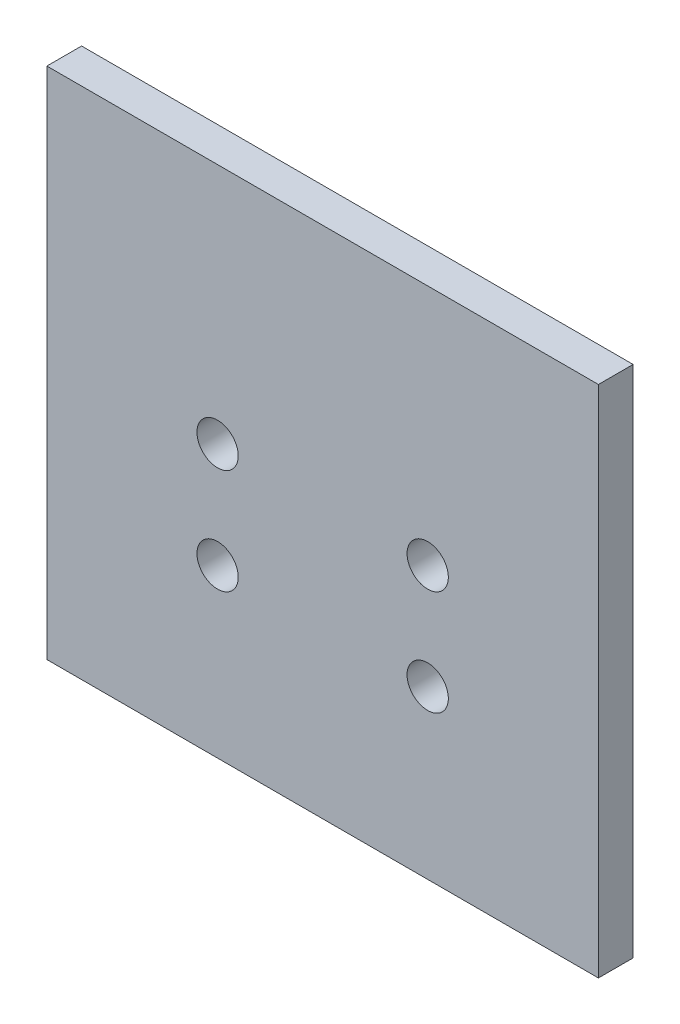
from build123d import *

# Parameters (mm, degrees)
SKETCH1_W           = 147
SKETCH1_H           = 137
SKETCH1_R           = 5.5
BOSS_EXTRUDE1_DEPTH = 9.25


with BuildPart() as part:
    # Sketch1 → Boss-Extrude1 (new body)
    with BuildSketch(Plane.XY.offset(9.25)):
        Rectangle(SKETCH1_W, SKETCH1_H)
        with Locations(Location((-28, -24, 0), (0, 0, 180))):
            Circle(SKETCH1_R, mode=Mode.SUBTRACT)
        with Locations(Location((28, -24, 0), (0, 0, 180))):
            Circle(SKETCH1_R, mode=Mode.SUBTRACT)
        with Locations(Location((28, 4, 0), (0, 0, 180))):
            Circle(SKETCH1_R, mode=Mode.SUBTRACT)
        with Locations(Location((-28, 4, 0), (0, 0, 180))):
            Circle(SKETCH1_R, mode=Mode.SUBTRACT)
    extrude(amount=-BOSS_EXTRUDE1_DEPTH)


solid = part.part
